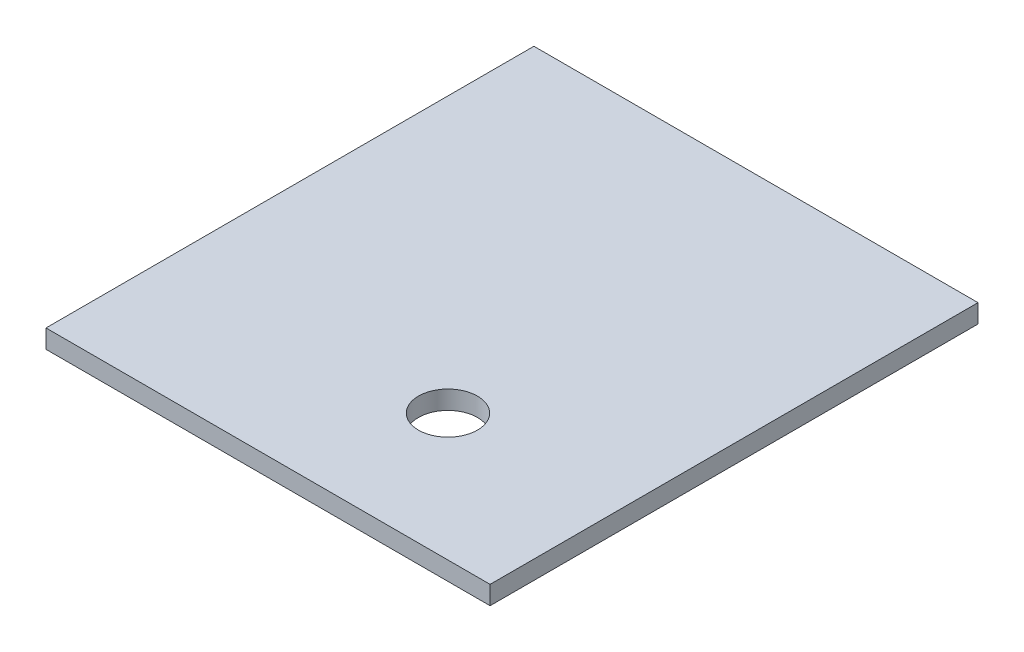
from build123d import *

# Parameters (mm, degrees)
SKETCH1_W           = 133.858
SKETCH1_H           = 147.066
BOSS_EXTRUDE1_DEPTH = 5.588
CUT_EXTRUDE1_REACH  = 101.588
SKETCH4_R           = 8.89


with BuildPart() as part:
    # Sketch1 → Boss-Extrude1 (new body)
    with BuildSketch(Plane(origin=(0, 0, 0), x_dir=(1, 0, 0), z_dir=(0, 1, 0))):
        Rectangle(SKETCH1_W, SKETCH1_H)
    extrude(amount=BOSS_EXTRUDE1_DEPTH)

    # Sketch4 → Cut-Extrude1 (cut, up to next)
    with BuildSketch(Plane(origin=(0, 5.588, 0), x_dir=(1, 0, 0), z_dir=(0, 1, 0)), mode=Mode.PRIVATE) as cut_extrude1_sk1:
        with Locations(Location((15.875, -35.179, 0), (0, 0, 270))):
            Circle(SKETCH4_R)
    cut_extrude1_tool1 = extrude(cut_extrude1_sk1.sketch, amount=-CUT_EXTRUDE1_REACH, mode=Mode.PRIVATE) & part.part
    add(cut_extrude1_tool1.solids().sort_by_distance((15.875, 5.588, 35.179))[0], mode=Mode.SUBTRACT)


solid = part.part
